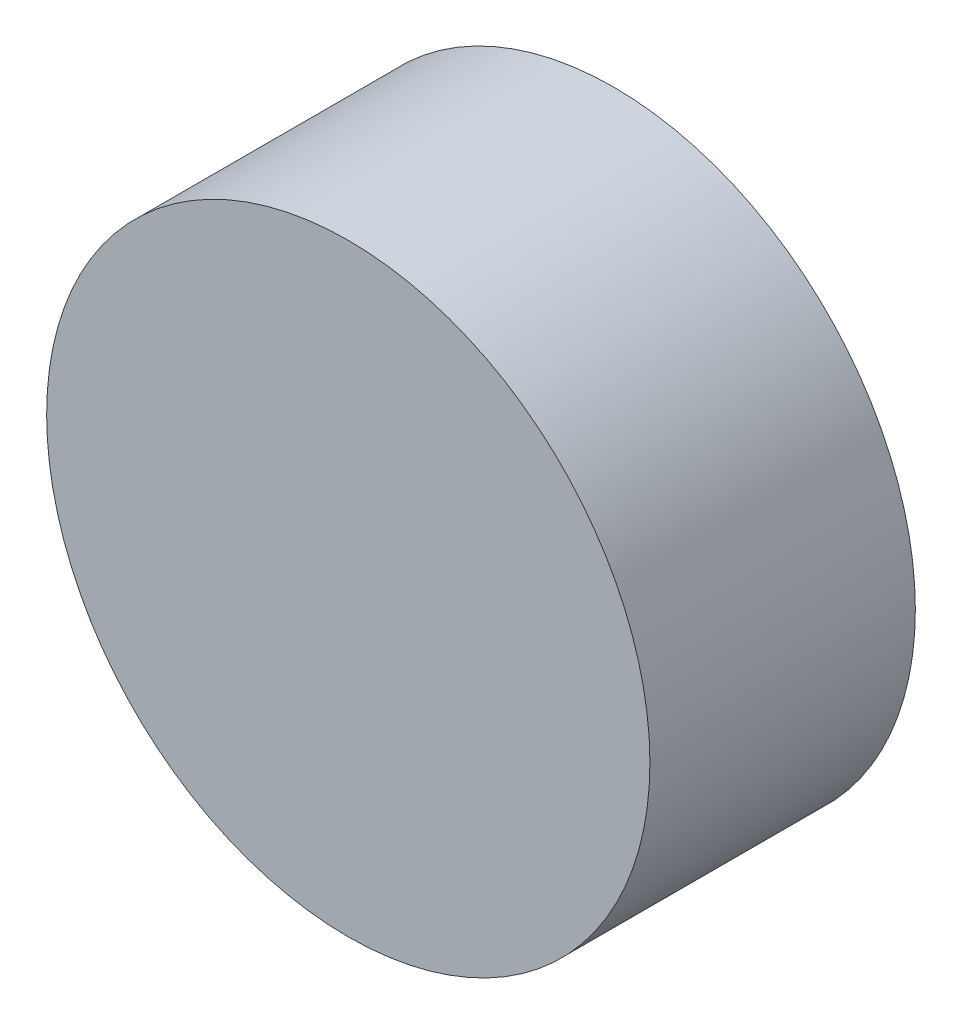
from build123d import *

# Parameters (mm, degrees)
SKETCH_1_R      = 12.5
EXTRUDE_1_DEPTH = 11


with BuildPart() as part:
    # 草图1 → 凸台-拉伸1 (new body)
    with BuildSketch(Plane.XY):
        Circle(SKETCH_1_R)
    extrude(amount=EXTRUDE_1_DEPTH)


solid = part.part
